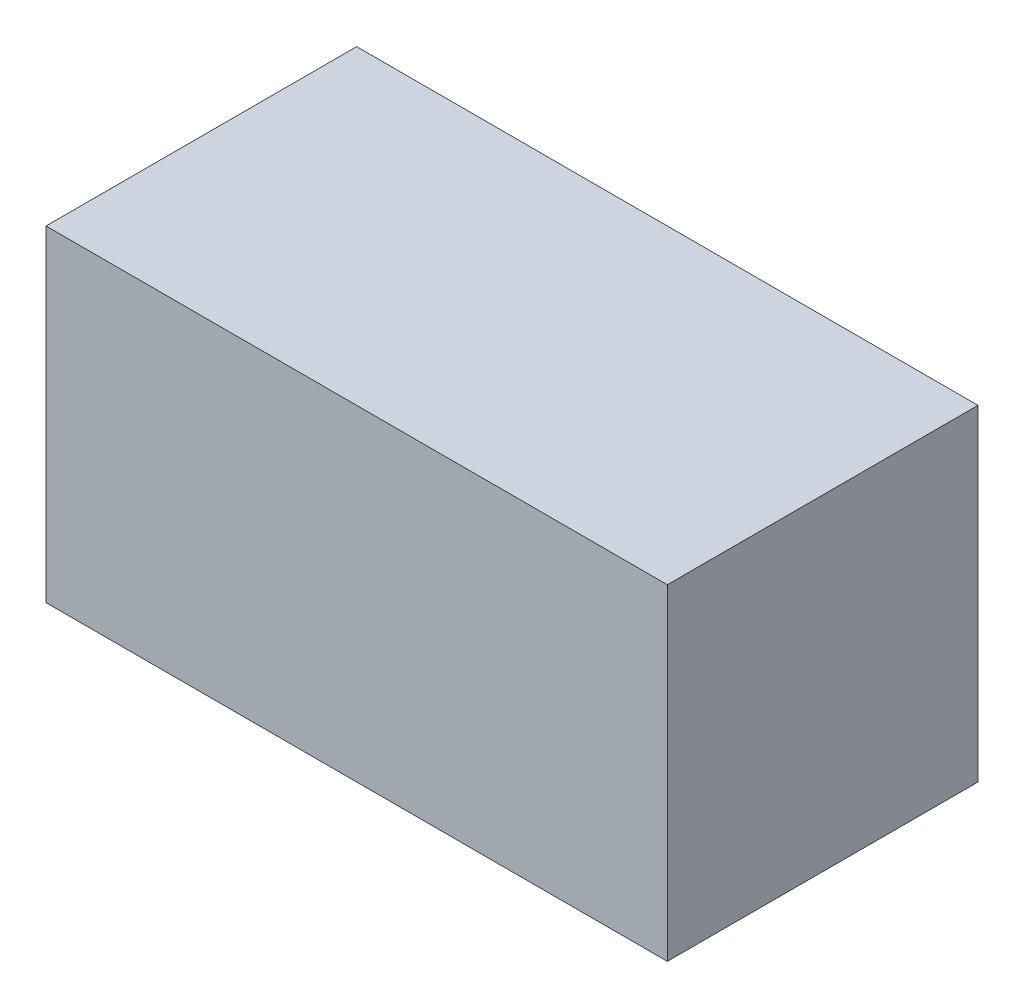
from build123d import *

# Parameters (mm, degrees)
CROQUIS_BASE_W          = 40
CROQUIS_BASE_H          = 20
SALIENTE_EXTRUIR1_DEPTH = 21
CROQUIS_SOCKET_W        = 6.9
CROQUIS_SOCKET_H        = 4
SALIENTE_EXTRUIR2_DEPTH = 1.5
CROQUIS_SOCKET_2_W      = 5.9
CROQUIS_SOCKET_2_H      = 3
SALIENTE_EXTRUIR4_DEPTH = 3.7
SALIENTE_EXTRUIR4_TAPER = 5


with BuildPart() as part:
    # Croquis base → Saliente-Extruir1 (new body)
    with BuildSketch(Plane(origin=(0, 0, 0), x_dir=(1, 0, 0), z_dir=(0, 1, 0))):
        Rectangle(CROQUIS_BASE_W, CROQUIS_BASE_H)
    extrude(amount=SALIENTE_EXTRUIR1_DEPTH)

    # Croquis socket → Saliente-Extruir2 (add)
    with BuildSketch(Plane.ZY.offset(20)):
        with Locations((0, 2)):
            Rectangle(CROQUIS_SOCKET_W, CROQUIS_SOCKET_H)
    extrude(amount=SALIENTE_EXTRUIR2_DEPTH)


with BuildPart() as body_2:
    # Croquis socket 2 → Saliente-Extruir4 (new body)
    with BuildSketch(Plane.ZY.offset(21.5)):
        with Locations((0, 2)):
            Rectangle(CROQUIS_SOCKET_2_W, CROQUIS_SOCKET_2_H)
    extrude(amount=SALIENTE_EXTRUIR4_DEPTH, taper=SALIENTE_EXTRUIR4_TAPER)


solid = Compound([part.part, body_2.part])
